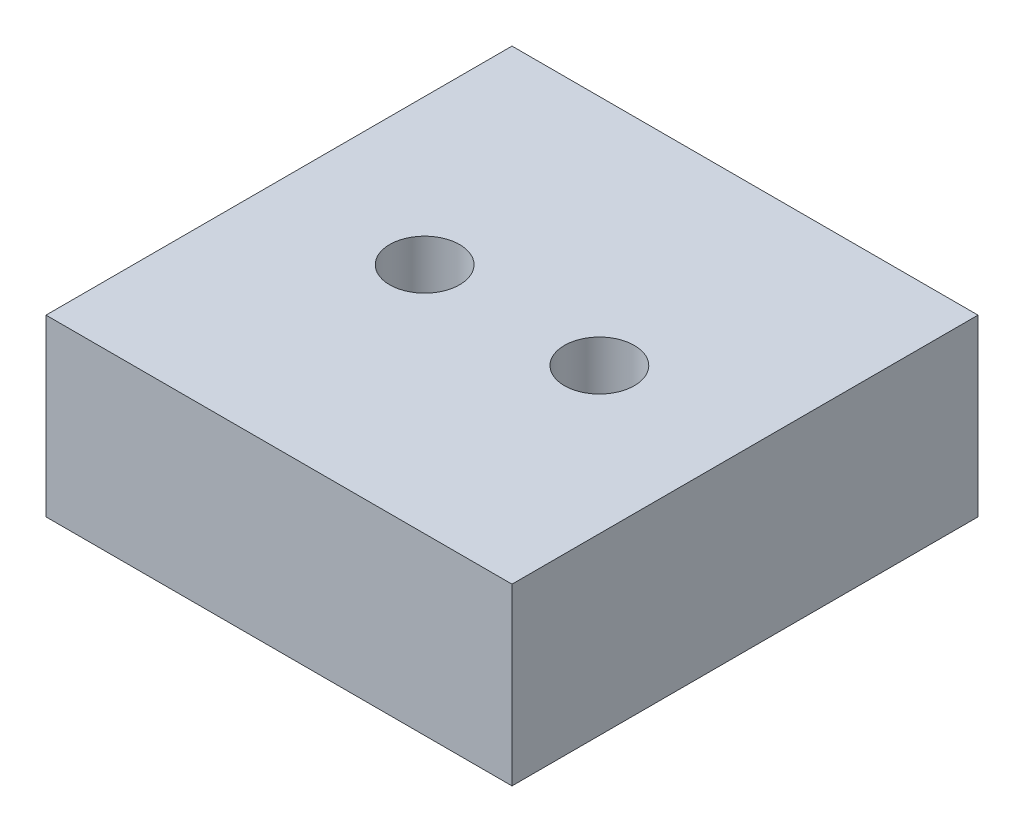
from build123d import *

# Parameters (mm, degrees)
SKETCH1_W           = 40
SKETCH1_H           = 40
SKETCH1_R           = 3
BOSS_EXTRUDE1_DEPTH = 15


with BuildPart() as part:
    # Sketch1 → Boss-Extrude1 (new body)
    with BuildSketch(Plane(origin=(0, 0, 0), x_dir=(1, 0, 0), z_dir=(0, 1, 0))):
        Rectangle(SKETCH1_W, SKETCH1_H)
        with Locations(Location((-7.5, 0, 0), (0, 0, 270))):
            Circle(SKETCH1_R, mode=Mode.SUBTRACT)
        with Locations(Location((7.5, 0, 0), (0, 0, 270))):
            Circle(SKETCH1_R, mode=Mode.SUBTRACT)
    extrude(amount=BOSS_EXTRUDE1_DEPTH)


solid = part.part
